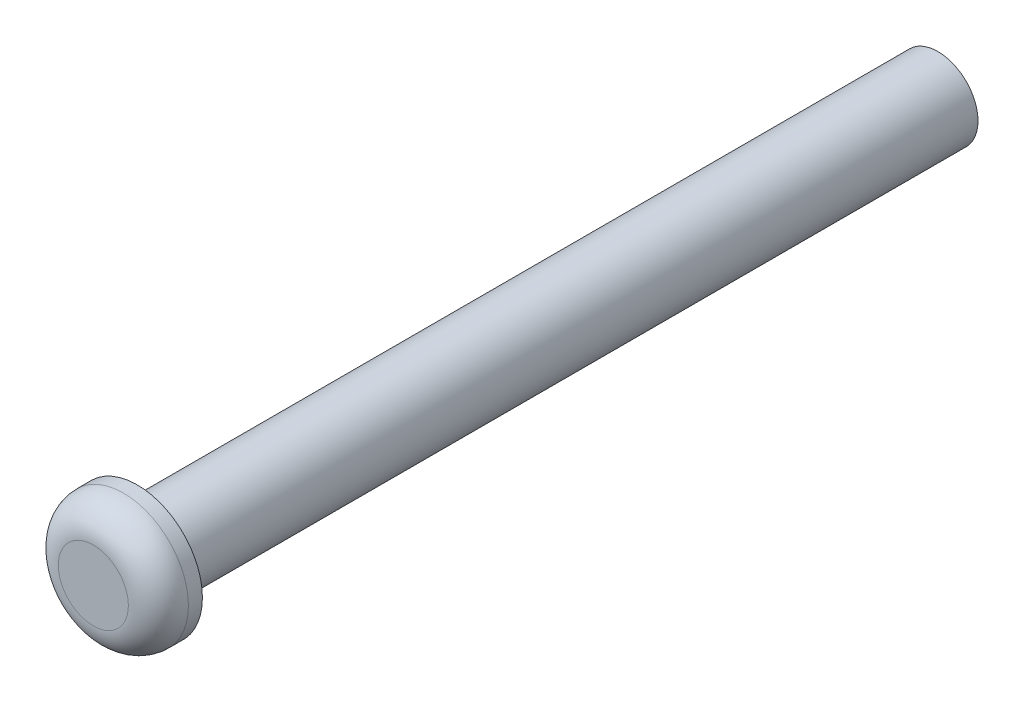
from build123d import *

# Parameters (mm, degrees)
SKETCH_1_R      = 2
EXTRUDE_1_DEPTH = 40
SKETCH_2_R      = 3.25
EXTRUDE_2_DEPTH = 2.2
FILLET_1_R      = 1.5


with BuildPart() as part:
    # 草图1 → 凸台-拉伸1 (new body)
    with BuildSketch(Plane.XY):
        Circle(SKETCH_1_R)
    extrude(amount=EXTRUDE_1_DEPTH)

    # 草图2 → 凸台-拉伸2 (add)
    with BuildSketch(Plane.XY.offset(40)):
        Circle(SKETCH_2_R)
    extrude(amount=EXTRUDE_2_DEPTH)

    # 圆角1
    fillet_1_edges = [part.edges().sort_by_distance(p)[0] for p in [
        (-3.25, 0, 42.2),
    ]]
    fillet(fillet_1_edges, radius=FILLET_1_R)


solid = part.part
